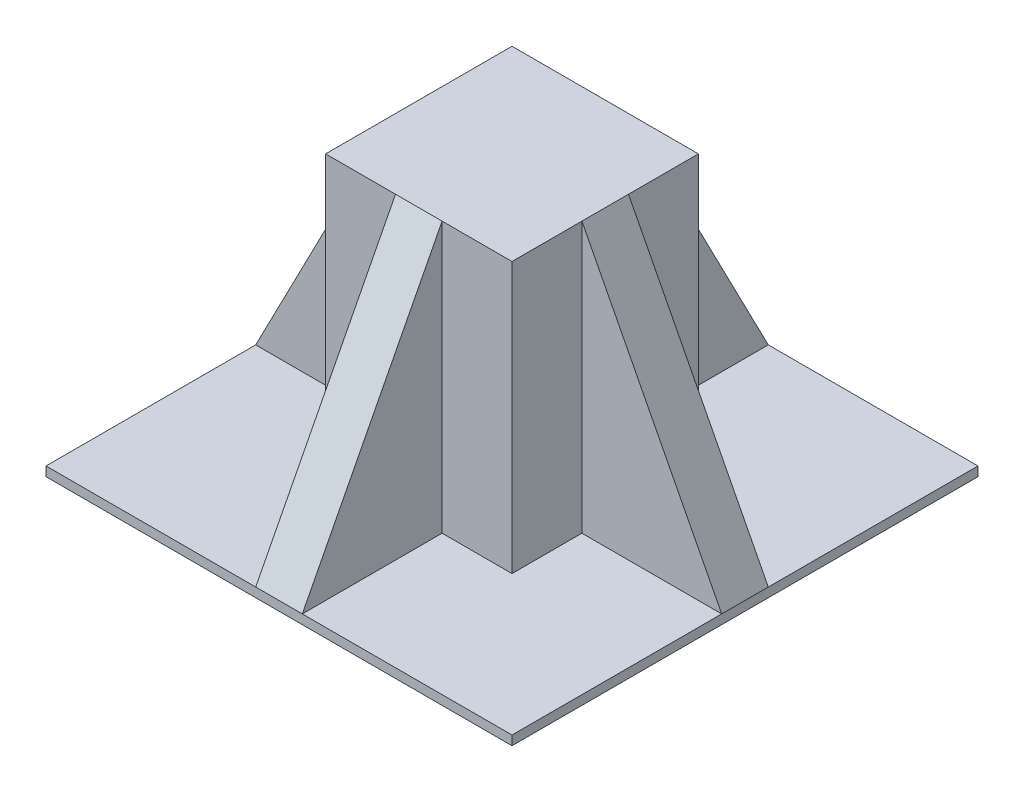
from build123d import *

# Parameters (mm, degrees)
CROQUIS2_W                   = 100
CROQUIS2_H                   = 100
CROQUIS2_W_2                 = 40
CROQUIS2_H_2                 = 40
SALIENTE_EXTRUIR1_DEPTH      = 2
CROQUIS2_2_W                 = 40
CROQUIS2_2_H                 = 40
SALIENTE_EXTRUIR2_DEPTH      = 60
SALIENTE_EXTRUIR3_DEPTH      = 5
SALIENTE_EXTRUIR3_DEPTH_BACK = 5
SALIENTE_EXTRUIR4_DEPTH      = 5
SALIENTE_EXTRUIR4_DEPTH_BACK = 5


with BuildPart() as part:
    # Croquis2 → Saliente-Extruir1 (new body)
    with BuildSketch(Plane(origin=(0, 0, 0), x_dir=(1, 0, 0), z_dir=(0, 1, 0))):
        Rectangle(CROQUIS2_W, CROQUIS2_H)
        Rectangle(CROQUIS2_W_2, CROQUIS2_H_2, mode=Mode.SUBTRACT)
    extrude(amount=SALIENTE_EXTRUIR1_DEPTH)

    # Croquis2<2> → Saliente-Extruir2 (add)
    with BuildSketch(Plane(origin=(0, 0, 0), x_dir=(1, 0, 0), z_dir=(0, 1, 0))):
        Rectangle(CROQUIS2_2_W, CROQUIS2_2_H)
    extrude(amount=SALIENTE_EXTRUIR2_DEPTH)

    # Croquis4 → Saliente-Extruir3 (add, two sides: drawn at the far end of the back side and taken through both)
    with BuildSketch(Plane(origin=(0, 0, 0), x_dir=(0, 0, -1), z_dir=(1, 0, 0)).offset(-SALIENTE_EXTRUIR3_DEPTH_BACK)):
        Polygon((20, 60), (50, 2), (20, 2), align=None)
        Polygon((-20, 2), (-50, 2), (-20, 60), align=None)
    extrude(amount=SALIENTE_EXTRUIR3_DEPTH + SALIENTE_EXTRUIR3_DEPTH_BACK)

    # Croquis5 → Saliente-Extruir4 (add, two sides: drawn at the far end of the back side and taken through both)
    with BuildSketch(Plane.XY.offset(-SALIENTE_EXTRUIR4_DEPTH_BACK)):
        Polygon((20, 60), (50, 2), (20, 2), align=None)
        Polygon((-20, 60), (-50, 2), (-20, 2), align=None)
    extrude(amount=SALIENTE_EXTRUIR4_DEPTH + SALIENTE_EXTRUIR4_DEPTH_BACK)


solid = part.part
